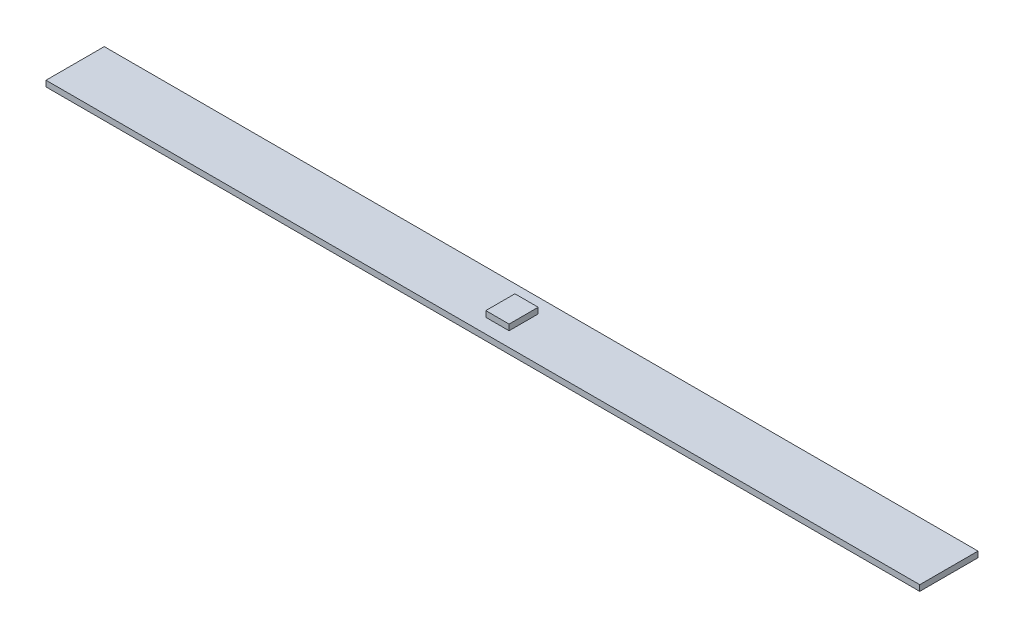
from build123d import *

# Parameters (mm, degrees)
SKETCH1_W           = 150
SKETCH1_H           = 10
BOSS_EXTRUDE1_DEPTH = 1
SKETCH2_W           = 4
SKETCH2_H           = 5
BOSS_EXTRUDE2_DEPTH = 1


with BuildPart() as part:
    # Sketch1 → Boss-Extrude1 (new body)
    with BuildSketch(Plane(origin=(0, 0, 0), x_dir=(1, 0, 0), z_dir=(0, 1, 0))):
        Rectangle(SKETCH1_W, SKETCH1_H)
    extrude(amount=BOSS_EXTRUDE1_DEPTH)

    # Sketch2 → Boss-Extrude2 (add)
    with BuildSketch(Plane(origin=(0, 1, 0), x_dir=(1, 0, 0), z_dir=(0, 1, 0))):
        Rectangle(SKETCH2_W, SKETCH2_H)
    extrude(amount=BOSS_EXTRUDE2_DEPTH)


solid = part.part
